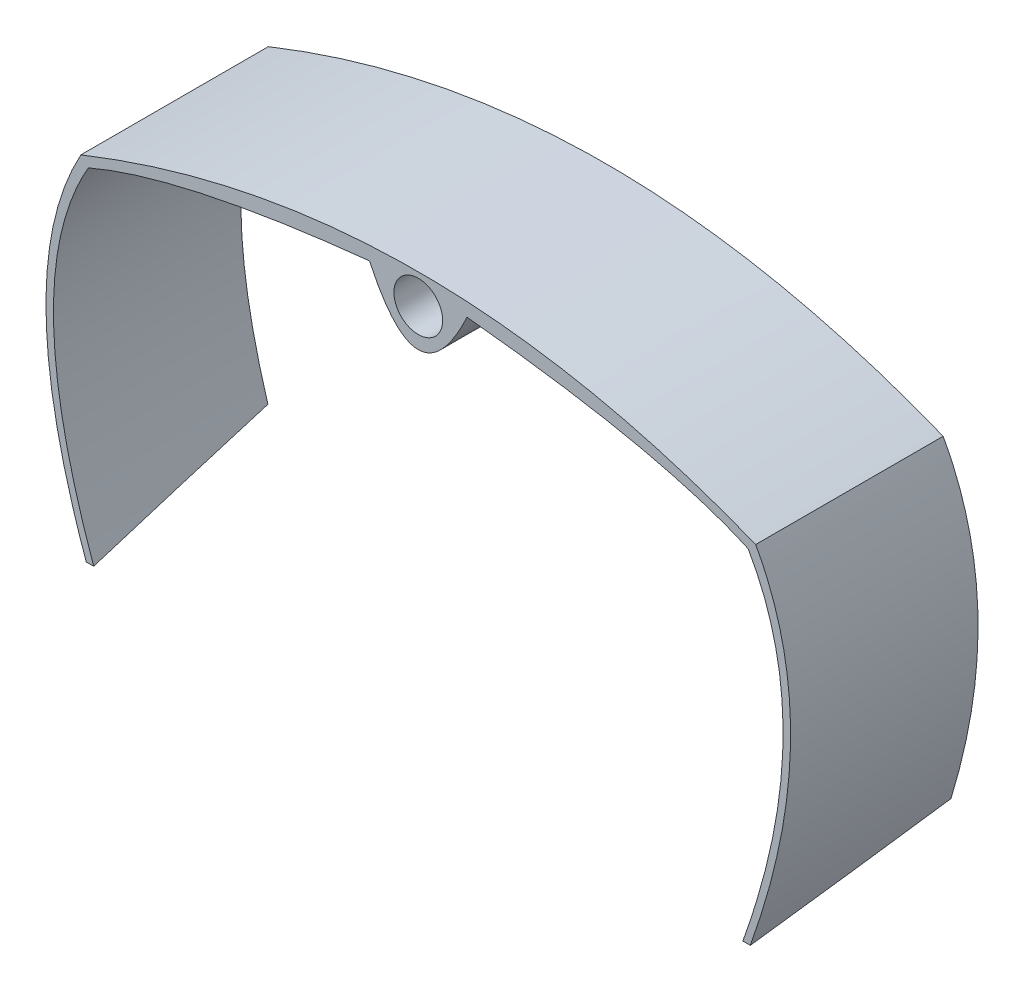
from build123d import *

# Parameters (mm, degrees)
SKETCH_1_R               = 3.25
EXTRUDE_1_DEPTH          = 25
CUT_EXTRUDE_1_DEPTH      = 82.79550394
CUT_EXTRUDE_1_DEPTH_BACK = 82.79550394


with BuildPart() as part:
    # 草圖1 → 填料-伸長1 (new body)
    with BuildSketch(Plane.XY):
        with BuildLine():
            Line((-41, -60), (-40, -60))
            add(Edge.make_bspline(
                [(-44, -6), (-55, -25), (-40, -60)],
                knots=[0, 0, 0, 1, 1, 1], degree=2))
            add(Edge.make_bspline(
                [(-6.5, 2), (-31.607950909, -0.616387712), (-44, -6)],
                knots=[0, 0, 0, 1, 1, 1], degree=2))
            add(Edge.make_bspline(
                [(-6.5, 2), (0, -12), (6.5, 2)],
                knots=[0, 0, 0, 1, 1, 1], degree=2))
            add(Edge.make_bspline(
                [(6.5, 2), (32.228671013, -0.616387712), (44, -6)],
                knots=[0, 0, 0, 1, 1, 1], degree=2))
            add(Edge.make_bspline(
                [(44, -6), (55, -25), (40, -60)],
                knots=[0, 0, 0, 1, 1, 1], degree=2))
            Line((40, -60), (41, -60))
            add(Edge.make_bspline(
                [(45, -5), (56, -25), (41, -60)],
                knots=[0, 0, 0, 1, 1, 1], degree=2))
            add(Edge.make_bspline(
                [(-45, -5), (0, 13), (45, -5)],
                knots=[0, 0, 0, 1, 1, 1], degree=2))
            add(Edge.make_bspline(
                [(-45, -5), (-56, -25), (-41, -60)],
                knots=[0, 0, 0, 1, 1, 1], degree=2))
        make_face()
        Circle(SKETCH_1_R, mode=Mode.SUBTRACT)
    extrude(amount=EXTRUDE_1_DEPTH)

    # 草圖2 → 除料-伸長1 (cut, two sides: drawn at the far end of the back side and taken through both)
    with BuildSketch(Plane(origin=(0, 0, 0), x_dir=(0, 0, -1), z_dir=(1, 0, 0)).offset(-CUT_EXTRUDE_1_DEPTH_BACK)):
        Polygon((-28.906277967, -52.492311819), (4.067188518, -45.468378129), (5.936036077, -63.083878207), (-26.90117602, -70.571484262), (-30.384906988, -68.381487837), align=None)
    extrude(amount=CUT_EXTRUDE_1_DEPTH + CUT_EXTRUDE_1_DEPTH_BACK, mode=Mode.SUBTRACT)


solid = part.part
